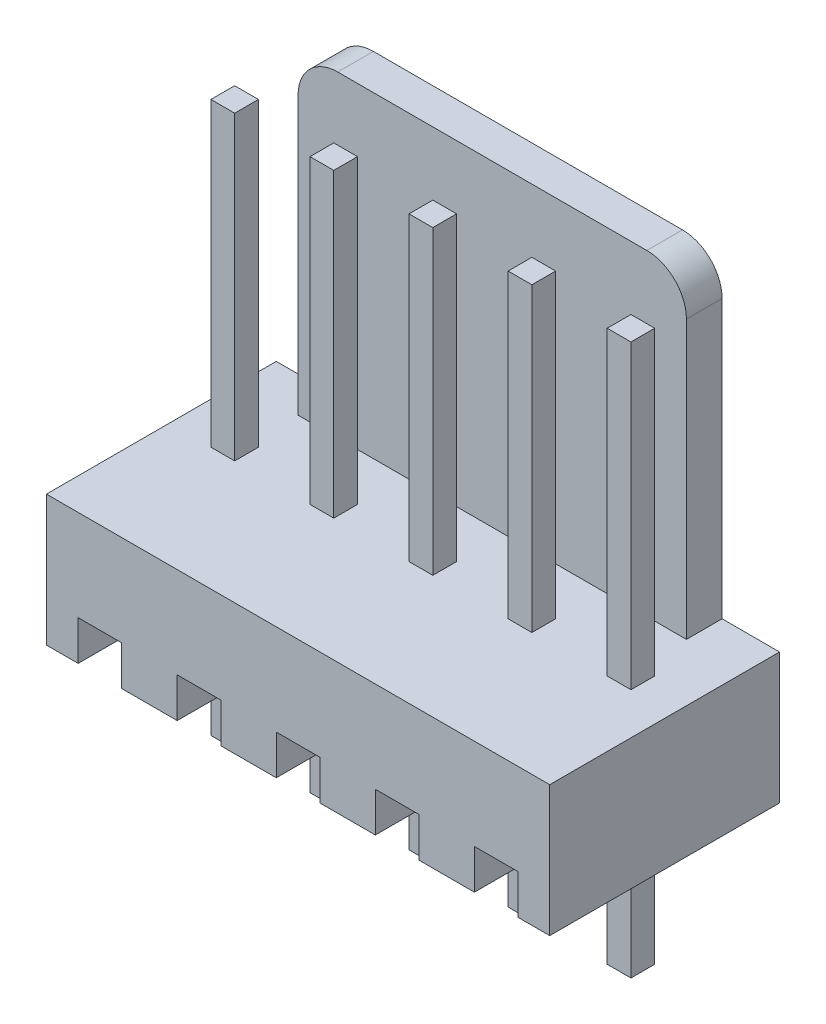
from build123d import *

# Parameters (mm, degrees)
CROQUIS1_W                   = 12.7
CROQUIS1_H                   = 5.8
SALIENTE_EXTRUIR1_DEPTH      = 3.3
CROQUIS2_W                   = 9.8
CROQUIS2_H                   = 0.9
SALIENTE_EXTRUIR2_DEPTH      = 8
REDONDEO1_R                  = 1
REDONDEO2_R                  = 1
CROQUIS3_W                   = 1.1
CROQUIS3_H                   = 5.8
CORTAR_EXTRUIR1_DEPTH        = 1
SALIENTE_EXTRUIR3_DEPTH      = 4
SALIENTE_EXTRUIR3_DEPTH_BACK = 9.9
CROQUIS4_W                   = 0.6
CROQUIS4_H                   = 0.6


with BuildPart() as part:
    # Croquis1 → Saliente-Extruir1 (new body)
    with BuildSketch(Plane(origin=(0, 0, 0), x_dir=(1, 0, 0), z_dir=(0, 1, 0))):
        Rectangle(CROQUIS1_W, CROQUIS1_H)
    extrude(amount=SALIENTE_EXTRUIR1_DEPTH)

    # Croquis2 → Saliente-Extruir2 (add)
    with BuildSketch(Plane(origin=(0, 3.3, 0), x_dir=(1, 0, 0), z_dir=(0, 1, 0))):
        with Locations((0, 2.45)):
            Rectangle(CROQUIS2_W, CROQUIS2_H)
    extrude(amount=SALIENTE_EXTRUIR2_DEPTH)

    # Redondeo1
    redondeo1_edges = [part.edges().sort_by_distance(p)[0] for p in [
        (4.9, 11.3, -2.45),
    ]]
    fillet(redondeo1_edges, radius=REDONDEO1_R)

    # Redondeo2
    redondeo2_edges = [part.edges().sort_by_distance(p)[0] for p in [
        (-4.9, 11.3, -2.45),
    ]]
    fillet(redondeo2_edges, radius=REDONDEO2_R)

    # Croquis3 → Cortar-Extruir1 (cut)
    with BuildSketch(Plane.XZ):
        with Locations((-5, 0)):
            Rectangle(CROQUIS3_W, CROQUIS3_H)
        with Locations((-2.5, 0)):
            Rectangle(CROQUIS3_W, CROQUIS3_H)
        Rectangle(CROQUIS3_W, CROQUIS3_H)
        with Locations((2.5, 0)):
            Rectangle(CROQUIS3_W, CROQUIS3_H)
        with Locations((5, 0)):
            Rectangle(CROQUIS3_W, CROQUIS3_H)
    extrude(amount=-CORTAR_EXTRUIR1_DEPTH, mode=Mode.SUBTRACT)

    # Croquis4 → Saliente-Extruir3 (add, two sides: drawn at the far end of the back side and taken through both)
    with BuildSketch(Plane(origin=(0, 1, 0), x_dir=(-1, 0, 0), z_dir=(0, -1, 0)).offset(-SALIENTE_EXTRUIR3_DEPTH_BACK)):
        with Locations((5, 0.5)):
            Rectangle(CROQUIS4_W, CROQUIS4_H)
        with Locations((2.5, 0.5)):
            Rectangle(CROQUIS4_W, CROQUIS4_H)
        with Locations((0, 0.5)):
            Rectangle(CROQUIS4_W, CROQUIS4_H)
        with Locations((-2.5, 0.5)):
            Rectangle(CROQUIS4_W, CROQUIS4_H)
        with Locations((-5, 0.5)):
            Rectangle(CROQUIS4_W, CROQUIS4_H)
    extrude(amount=SALIENTE_EXTRUIR3_DEPTH + SALIENTE_EXTRUIR3_DEPTH_BACK)


solid = part.part
